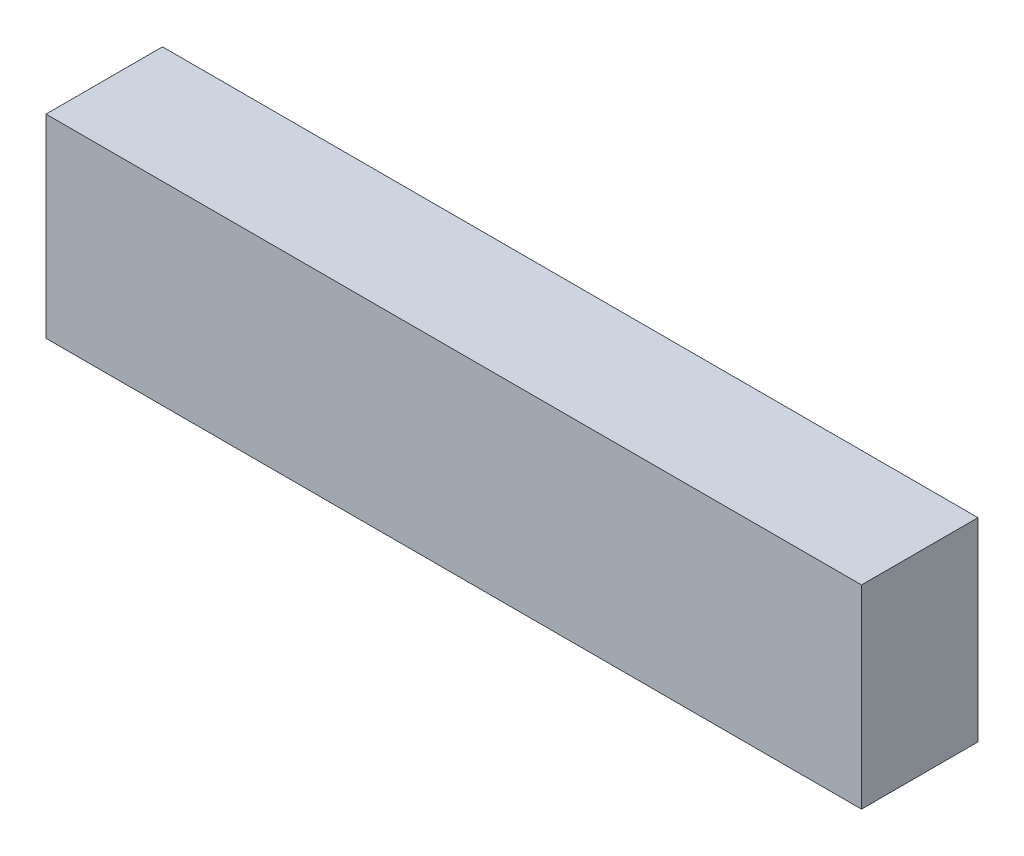
from build123d import *

# Parameters (mm, degrees)
SKETCH_1_W        = 700
SKETCH_1_H        = 166.7
EXTRUDE_304_DEPTH = 100


with BuildPart() as part:
    # 草图1 → Extrude 304 (new body)
    with BuildSketch(Plane.XY):
        with Locations((350, 83.35)):
            Rectangle(SKETCH_1_W, SKETCH_1_H)
    extrude(amount=EXTRUDE_304_DEPTH)


solid = part.part
